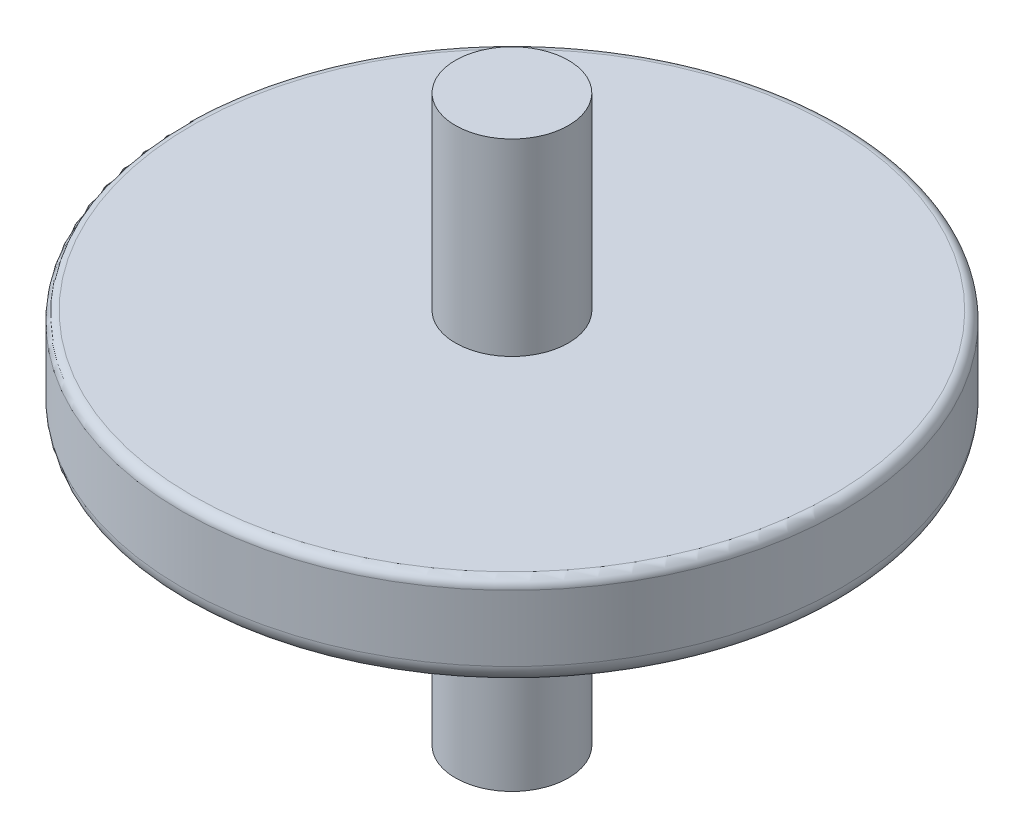
from build123d import *

# Parameters (mm, degrees)
SKETCH1_R           = 3
BOSS_EXTRUDE1_DEPTH = 15
SKETCH3_R           = 17.5
BOSS_EXTRUDE2_DEPTH = 5
SKETCH4_R           = 3
BOSS_EXTRUDE3_DEPTH = 10
FILLET4_R           = 1
FILLET5_R           = 0.5


with BuildPart() as part:
    # Sketch1 → Boss-Extrude1 (new body)
    with BuildSketch(Plane(origin=(0, 0, 0), x_dir=(1, 0, 0), z_dir=(0, 1, 0))):
        with Locations(Location((0, 0, 0), (0, 0, 270))):
            Circle(SKETCH1_R)
    extrude(amount=BOSS_EXTRUDE1_DEPTH)

    # Sketch3 → Boss-Extrude2 (add)
    with BuildSketch(Plane(origin=(0, 15, 0), x_dir=(1, 0, 0), z_dir=(0, 1, 0))):
        with Locations(Location((0, 0, 0), (0, 0, 270))):
            Circle(SKETCH3_R)
    extrude(amount=BOSS_EXTRUDE2_DEPTH)

    # Sketch4 → Boss-Extrude3 (add)
    with BuildSketch(Plane(origin=(0, 20, 0), x_dir=(1, 0, 0), z_dir=(0, 1, 0))):
        with Locations(Location((0, 0, 0), (0, 0, 270))):
            Circle(SKETCH4_R)
    extrude(amount=BOSS_EXTRUDE3_DEPTH)

    # Fillet4
    fillet4_edges = [part.edges().sort_by_distance(p)[0] for p in [
        (0, 15, -17.5),
    ]]
    fillet(fillet4_edges, radius=FILLET4_R)

    # Fillet5
    fillet5_edges = [part.edges().sort_by_distance(p)[0] for p in [
        (0, 20, -17.5),
    ]]
    fillet(fillet5_edges, radius=FILLET5_R)


solid = part.part
